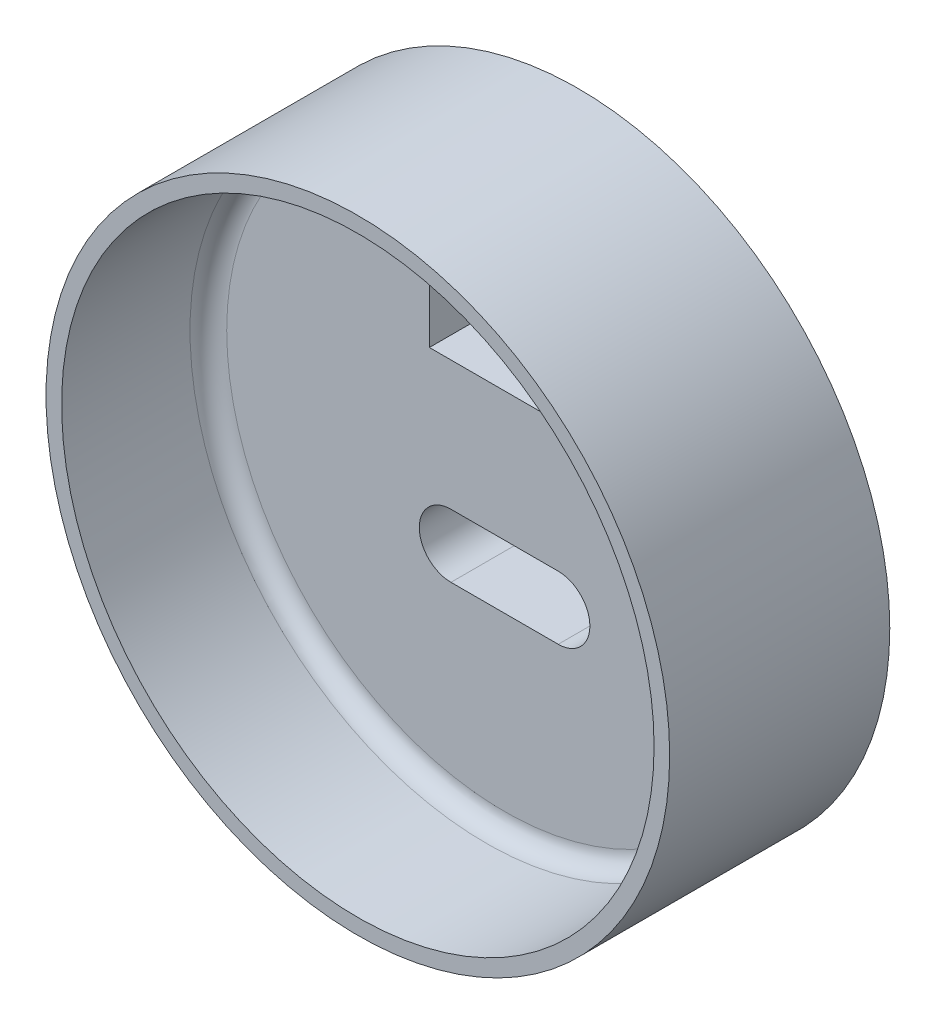
from build123d import *

# Parameters (mm, degrees)
SKETCH2_R           = 17
BOSS_EXTRUDE1_DEPTH = 12
SKETCH3_R           = 16.15
SKETCH3_R_2         = 10
CUT_EXTRUDE1_DEPTH  = 8
FILLET1_R           = 1
SKETCH4_W           = 8.2
SKETCH4_H           = 3.2
CUT_EXTRUDE2_DEPTH  = 27.870057685


with BuildPart() as part:
    # Sketch2 → Boss-Extrude1 (new body)
    with BuildSketch(Plane.XY):
        Circle(SKETCH2_R)
    extrude(amount=BOSS_EXTRUDE1_DEPTH)

    # Sketch3 → Cut-Extrude1 (cut)
    # profile 1 of 2: a face of its own
    with BuildSketch(Plane.XY.offset(12)):
        Circle(SKETCH3_R)
        Circle(SKETCH3_R_2, mode=Mode.SUBTRACT)
    # profile 2 of 2: a face of its own
    with BuildSketch(Plane.XY.offset(12)):
        Circle(SKETCH3_R_2)
    extrude(amount=-CUT_EXTRUDE1_DEPTH, mode=Mode.SUBTRACT)

    # Fillet1
    fillet1_edges = [part.edges().sort_by_distance(p)[0] for p in [
        (-16.15, 0, 4),
    ]]
    fillet(fillet1_edges, radius=FILLET1_R)

    # Sketch4 → Cut-Extrude2 (cut, through all)
    with BuildSketch(Plane(origin=(0, 0, 0), x_dir=(-1, 0, 0), z_dir=(0, 0, -1))):
        with Locations((0, 6.312686907)):
            Rectangle(SKETCH4_W, SKETCH4_H)
        with BuildLine():
            Line((2.925, -5.786814383), (-2.925, -5.786814383))
            ThreePointArc((-2.925, -5.786814383), (-4.65, -4.061814383), (-2.925, -2.336814383))
            Line((-2.925, -2.336814383), (2.925, -2.336814383))
            ThreePointArc((2.925, -2.336814383), (4.65, -4.061814383), (2.925, -5.786814383))
        make_face()
    extrude(amount=-CUT_EXTRUDE2_DEPTH, mode=Mode.SUBTRACT)


solid = part.part
